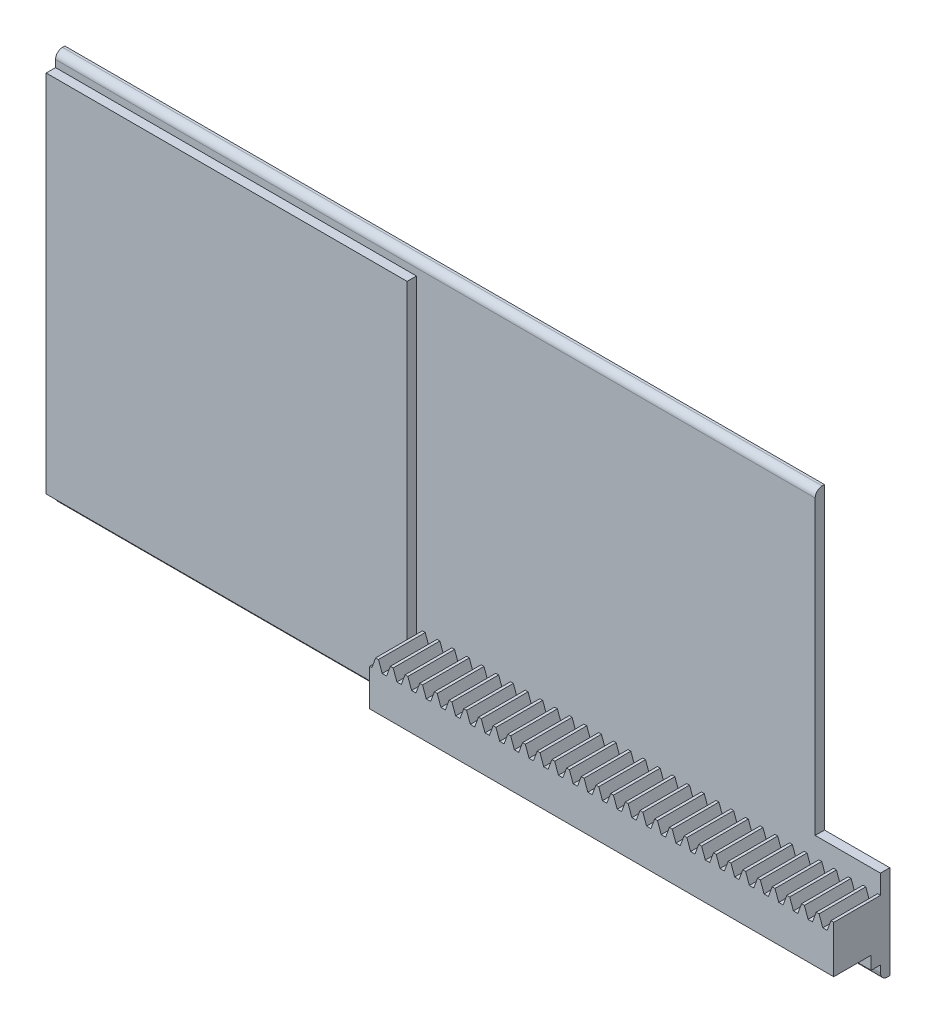
from build123d import *

# Parameters (mm, degrees)
SKETCH1_W           = 206.375
SKETCH1_H           = 106.68
BOSS_EXTRUDE1_DEPTH = 2.54
BOSS_EXTRUDE2_DEPTH = 12.7
SKETCH3_W           = 17.745286293
SKETCH3_H           = 25.4
BOSS_EXTRUDE3_DEPTH = 2.54
FILLET1_R           = 1.905
BOSS_EXTRUDE4_DEPTH = 2.54
SKETCH6_R           = 38.1
CUT_EXTRUDE1_DEPTH  = 1.5875


with BuildPart() as part:
    # Sketch1 → Boss-Extrude1 (new body)
    with BuildSketch(Plane.XY):
        with Locations((49.2125, 0)):
            Rectangle(SKETCH1_W, SKETCH1_H)
    extrude(amount=BOSS_EXTRUDE1_DEPTH)

    # Sketch2 → Boss-Extrude2 (add)
    with BuildSketch(Plane.XY.offset(2.54)):
        Polygon((170.145286293, -33.159030477), (169.379659355, -33.159030477), (168.362726521, -35.953030477), (167.172396462, -35.953030477), (166.155463627, -33.159030477), (165.38983669, -33.159030477), (164.372903855, -35.953030477), (163.182573796, -35.953030477), (162.165640962, -33.159030477), (161.400014024, -33.159030477), (160.38308119, -35.953030477), (159.192751131, -35.953030477), (158.175818296, -33.159030477), (157.410191359, -33.159030477), (156.393258524, -35.953030477), (155.202928465, -35.953030477), (154.185995631, -33.159030477), (153.420368693, -33.159030477), (152.403435859, -35.953030477), (151.2131058, -35.953030477), (150.196172965, -33.159030477), (149.430546028, -33.159030477), (148.413613193, -35.953030477), (147.223283134, -35.953030477), (146.2063503, -33.159030477), (145.440723362, -33.159030477), (144.423790528, -35.953030477), (143.233460469, -35.953030477), (142.216527634, -33.159030477), (141.450900697, -33.159030477), (140.433967862, -35.953030477), (139.243637803, -35.953030477), (138.226704969, -33.159030477), (137.461078031, -33.159030477), (136.444145197, -35.953030477), (135.253815138, -35.953030477), (134.236882303, -33.159030477), (133.471255366, -33.159030477), (132.454322531, -35.953030477), (131.263992472, -35.953030477), (130.247059638, -33.159030477), (129.4814327, -33.159030477), (128.464499866, -35.953030477), (127.274169807, -35.953030477), (126.257236972, -33.159030477), (125.491610035, -33.159030477), (124.4746772, -35.953030477), (123.284347141, -35.953030477), (122.267414307, -33.159030477), (121.501787369, -33.159030477), (120.484854535, -35.953030477), (119.294524476, -35.953030477), (118.277591641, -33.159030477), (117.511964704, -33.159030477), (116.495031869, -35.953030477), (115.30470181, -35.953030477), (114.287768976, -33.159030477), (113.522142038, -33.159030477), (112.505209204, -35.953030477), (111.314879145, -35.953030477), (110.29794631, -33.159030477), (109.532319373, -33.159030477), (108.515386538, -35.953030477), (107.325056479, -35.953030477), (106.308123645, -33.159030477), (105.542496707, -33.159030477), (104.525563873, -35.953030477), (103.335233814, -35.953030477), (102.318300979, -33.159030477), (101.552674042, -33.159030477), (100.535741207, -35.953030477), (99.345411148, -35.953030477), (98.328478314, -33.159030477), (97.562851376, -33.159030477), (96.545918542, -35.953030477), (95.355588483, -35.953030477), (94.338655648, -33.159030477), (93.573028711, -33.159030477), (92.556095876, -35.953030477), (91.365765817, -35.953030477), (90.348832983, -33.159030477), (89.583206045, -33.159030477), (88.566273211, -35.953030477), (87.375943152, -35.953030477), (86.359010317, -33.159030477), (85.59338338, -33.159030477), (84.576450545, -35.953030477), (83.386120486, -35.953030477), (82.369187652, -33.159030477), (81.603560714, -33.159030477), (80.58662788, -35.953030477), (79.396297821, -35.953030477), (78.379364986, -33.159030477), (77.613738049, -33.159030477), (76.596805214, -35.953030477), (75.406475155, -35.953030477), (74.389542321, -33.159030477), (73.623915383, -33.159030477), (72.606982549, -35.953030477), (71.41665249, -35.953030477), (70.399719655, -33.159030477), (69.634092718, -33.159030477), (68.617159883, -35.953030477), (67.426829824, -35.953030477), (66.40989699, -33.159030477), (65.644270052, -33.159030477), (64.627337218, -35.953030477), (63.437007159, -35.953030477), (62.420074324, -33.159030477), (61.654447387, -33.159030477), (60.637514552, -35.953030477), (59.447184493, -35.953030477), (58.430251659, -33.159030477), (57.664624721, -33.159030477), (56.647691887, -35.953030477), (55.457361828, -35.953030477), (54.440428993, -33.159030477), (53.674802056, -33.159030477), (52.657869221, -35.953030477), (51.467539162, -35.953030477), (50.450606328, -33.159030477), (49.68497939, -33.159030477), (48.668046556, -35.953030477), (47.477716497, -35.953030477), (46.460783662, -33.159030477), (45.695156725, -33.159030477), (44.67822389, -35.953030477), (44.083058861, -35.953030477), (44.083058861, -45.979871745), (170.145286293, -45.979871745), align=None)
    extrude(amount=BOSS_EXTRUDE2_DEPTH)

    # Sketch3 → Boss-Extrude3 (add)
    with BuildSketch(Plane(origin=(0, 0, 0), x_dir=(-1, 0, 0), z_dir=(0, 0, -1))):
        with Locations((-161.272643147, -40.64)):
            Rectangle(SKETCH3_W, SKETCH3_H)
    extrude(amount=-BOSS_EXTRUDE3_DEPTH)

    # Fillet1
    fillet1_edges = [part.edges().sort_by_distance(p)[0] for p in [
        (58.085143146, -53.34, 2.54),
        (49.2125, 53.34, 2.54),
    ]]
    fillet(fillet1_edges, radius=FILLET1_R)

    # Sketch5 → Boss-Extrude4 (add)
    with BuildSketch(Plane.XY.offset(2.54)):
        Polygon((-53.975, 49.53), (44.083058861, 49.53), (44.083058861, -45.979871745), (170.145286293, -45.979871745), (170.145286293, -49.53), (44.083058861, -49.53), (-53.975, -49.53), align=None)
    extrude(amount=BOSS_EXTRUDE4_DEPTH)

    # Sketch6 → Cut-Extrude1 (cut)
    with BuildSketch(Plane(origin=(0, 0, 0), x_dir=(-1, 0, 0), z_dir=(0, 0, -1))):
        Circle(SKETCH6_R)
    extrude(amount=-CUT_EXTRUDE1_DEPTH, mode=Mode.SUBTRACT)


solid = part.part
